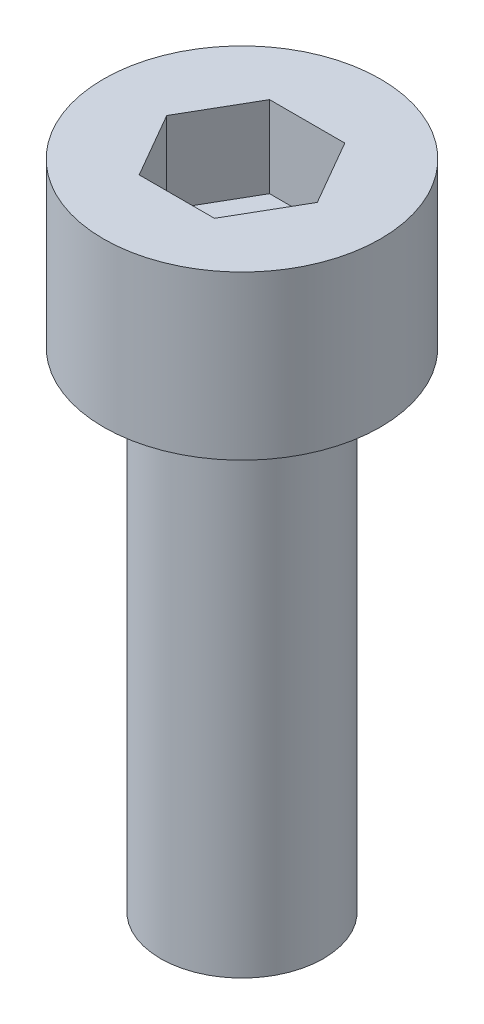
from build123d import *

# Parameters (mm, degrees)
CUT_EXTRUDE1_DEPTH = 2.5


with BuildPart() as part:
    # Sketch1 → Revolve1 (revolve)
    with BuildSketch(Plane.XY, mode=Mode.PRIVATE) as revolve1_sk:
        Polygon((0, 0), (2.5, 0), (2.5, 15), (4.25, 15), (4.25, 20), (0, 20), align=None)
    revolve(revolve1_sk.sketch.rotate(Axis((0, 20, 0), (0, -1, 0)), 90), axis=Axis((0, 20, 0), (0, -1, 0)))

    # Sketch2 → Cut-Extrude1 (cut)
    with BuildSketch(Plane(origin=(0, 20, 0), x_dir=(1, 0, 0), z_dir=(0, 1, 0))):
        Polygon((1.154700538, 2), (-1.154700538, 2), (-2.309401077, 0), (-1.154700538, -2), (1.154700538, -2), (2.309401077, 0), align=None)
    extrude(amount=-CUT_EXTRUDE1_DEPTH, mode=Mode.SUBTRACT)


solid = part.part
